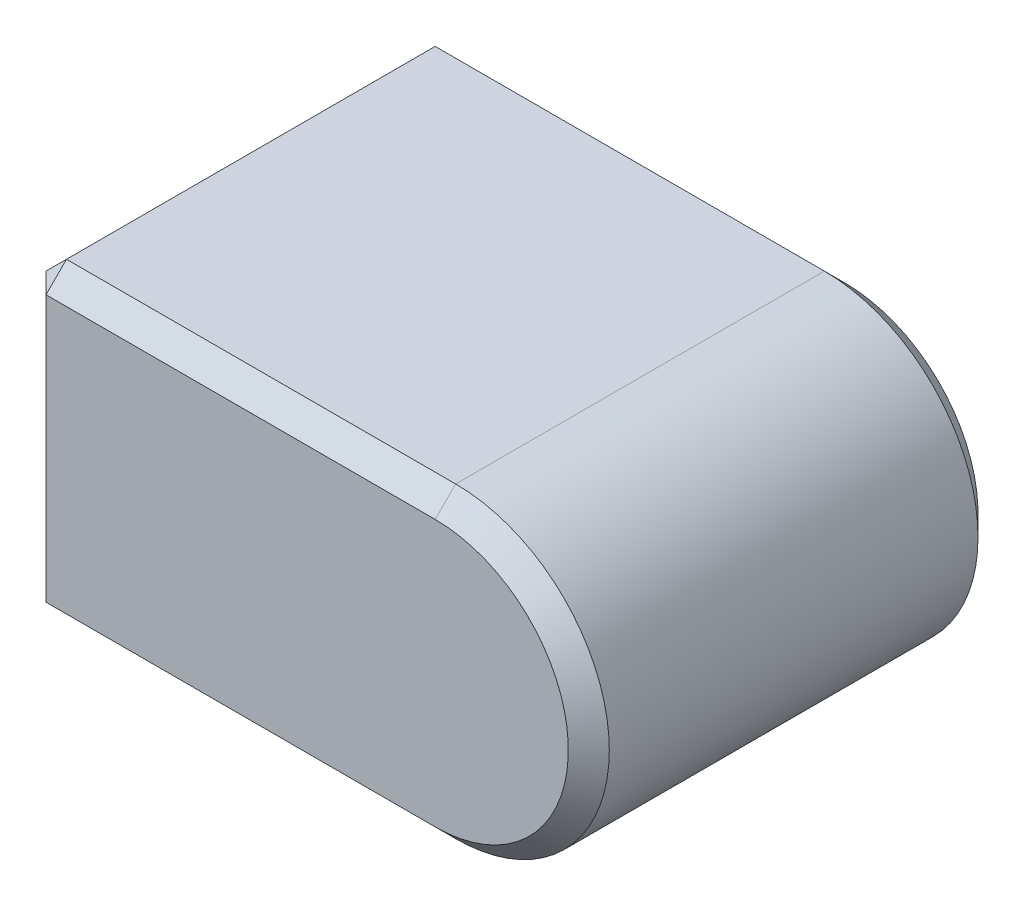
from build123d import *

# Parameters (mm, degrees)
EXTRUDE_1_DEPTH = 4
CHAMFER_1_SIZE  = 0.2


with BuildPart() as part:
    # 草图1 → 凸台-拉伸1 (new body)
    with BuildSketch(Plane.XY):
        with BuildLine():
            Line((-2, -1.5), (2, -1.5))
            ThreePointArc((2, -1.5), (3.5, 0), (2, 1.5))
            Line((2, 1.5), (-2, 1.5))
            Line((-2, 1.5), (-2, -1.5))
        make_face()
    extrude(amount=EXTRUDE_1_DEPTH)

    # 倒角1
    chamfer_1_edges = [part.edges().sort_by_distance(p)[0] for p in [
        (-2, 0, 4),
        (0, -1.5, 4),
        (3.5, 0, 4),
        (0, -1.5, 0),
        (-2, 0, 0),
        (0, 1.5, 0),
        (3.5, 0, 0),
        (-2, -1.5, 2),
        (-2, 1.5, 2),
        (0, 1.5, 4),
    ]]
    chamfer(chamfer_1_edges, length=CHAMFER_1_SIZE)


solid = part.part
